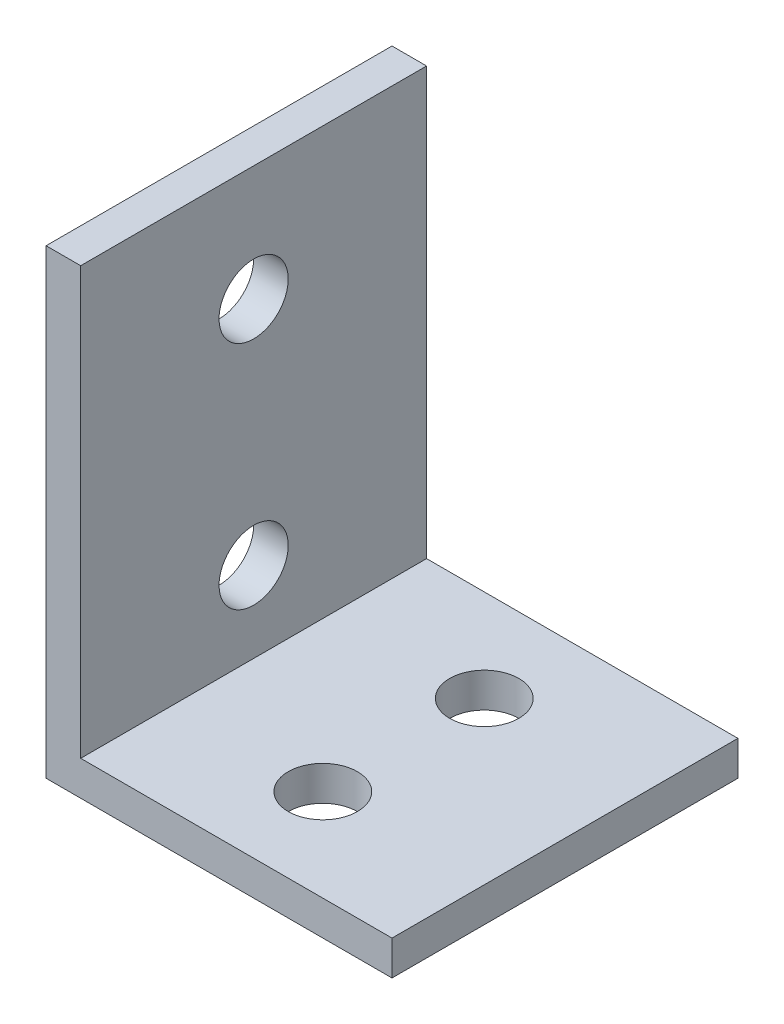
from build123d import *

# Parameters (mm, degrees)
EXTRUSION1_DEPTH = 15
ESQUISSE2_R      = 1.5
EXTRUSION2_DEPTH = 15
ESQUISSE3_R      = 1.5
EXTRUSION3_DEPTH = 15


with BuildPart() as part:
    # Esquisse1 → Extrusion1 (new body)
    with BuildSketch(Plane.XY):
        Polygon((-28.567581117, 0.000842105), (-28.567581117, -19.999157895), (-13.567581117, -19.999157895), (-13.567581117, -18.499157895), (-27.067581117, -18.499157895), (-27.067581117, 0.000842105), align=None)
    extrude(amount=EXTRUSION1_DEPTH)

    # Esquisse2 → Extrusion2 (cut)
    with BuildSketch(Plane(origin=(0, -18.499157895, 0), x_dir=(-1, 0, 0), z_dir=(0, 1, 0))):
        with Locations((20.567581117, 4)):
            Circle(ESQUISSE2_R)
        with Locations((20.567581117, 11)):
            Circle(ESQUISSE2_R)
    extrude(amount=-EXTRUSION2_DEPTH, mode=Mode.SUBTRACT)

    # Esquisse3 → Extrusion3 (cut)
    with BuildSketch(Plane(origin=(-27.067581117, 0, 0), x_dir=(0, 0, -1), z_dir=(1, 0, 0))):
        with Locations(Location((-7.5, -4.999157895, 0), (0, 0, 90))):
            Circle(ESQUISSE3_R)
        with Locations(Location((-7.5, -14.999157895, 0), (0, 0, 90))):
            Circle(ESQUISSE3_R)
    extrude(amount=-EXTRUSION3_DEPTH, mode=Mode.SUBTRACT)


solid = part.part
